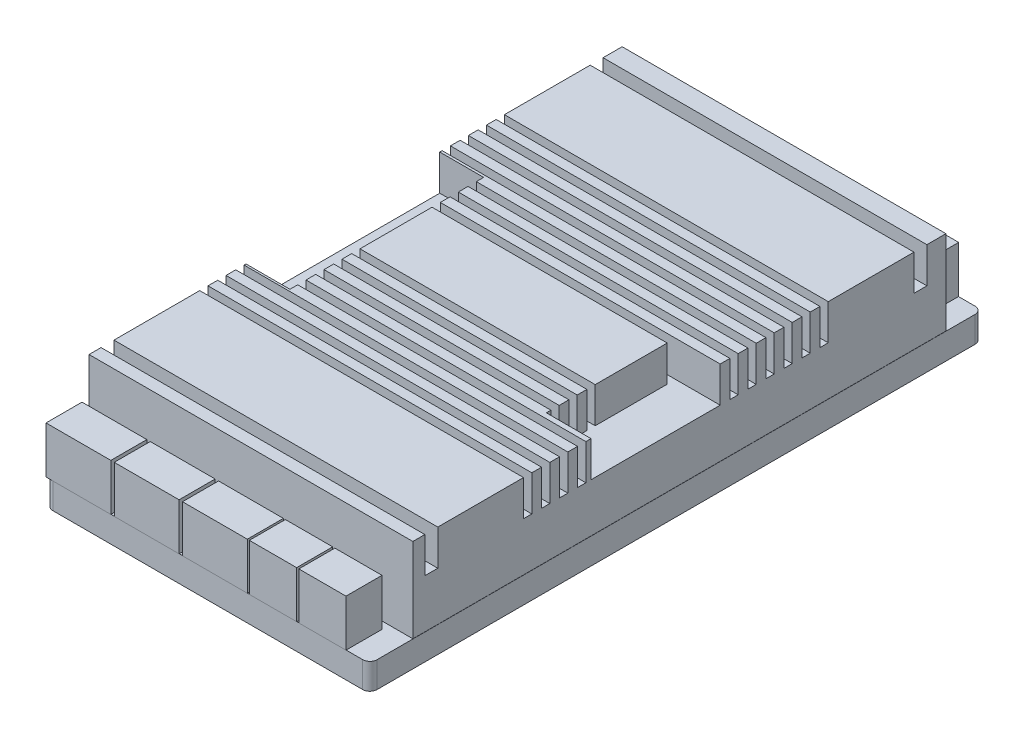
from build123d import *

# Parameters (mm, degrees)
BOSS_EXTRUDE1_DEPTH = 7.2
SKETCH2_W           = 89.9
SKETCH2_H           = 148
BOSS_EXTRUDE2_DEPTH = 23.4
SKETCH3_W           = 12.2
SKETCH3_H           = 53.8
SKETCH3_W_2         = 12.4
SKETCH3_H_2         = 34.48
CUT_EXTRUDE1_DEPTH  = 9.9
SKETCH4_W           = 89.9
SKETCH4_H           = 3.586904051
SKETCH4_W_2         = 90
SKETCH4_H_2         = 2.297698364
CUT_EXTRUDE2_DEPTH  = 9.9
SKETCH5_W           = 18
SKETCH5_H           = 10
SKETCH5_W_2         = 13.128765808
SKETCH5_W_3         = 13.081709299
BOSS_EXTRUDE3_DEPTH = 13


with BuildPart() as part:
    # Sketch1 → Boss-Extrude1 (new body)
    with BuildSketch(Plane(origin=(0, 0, 0), x_dir=(1, 0, 0), z_dir=(0, 1, 0))):
        with BuildLine():
            Line((43, -85), (-43, -85))
            ThreePointArc((-43, -85), (-44.414213562, -84.414213562), (-45, -83))
            Line((-45, -83), (-45, 83))
            ThreePointArc((-45, 83), (-44.414213562, 84.414213562), (-43, 85))
            Line((-43, 85), (43, 85))
            ThreePointArc((43, 85), (44.414213562, 84.414213562), (45, 83))
            Line((45, 83), (45, -83))
            ThreePointArc((45, -83), (44.414213562, -84.414213562), (43, -85))
        make_face()
    extrude(amount=BOSS_EXTRUDE1_DEPTH)

    # Sketch2 → Boss-Extrude2 (add)
    with BuildSketch(Plane(origin=(0, 7.2, 0), x_dir=(1, 0, 0), z_dir=(0, 1, 0))):
        with Locations((0, 0.976122618)):
            Rectangle(SKETCH2_W, SKETCH2_H)
    extrude(amount=BOSS_EXTRUDE2_DEPTH)

    # Sketch3 → Cut-Extrude1 (cut)
    with BuildSketch(Plane(origin=(0, 30.6, 0), x_dir=(1, 0, 0), z_dir=(0, 1, 0))):
        with Locations((-38.85, -2.560293939)):
            Rectangle(SKETCH3_W, SKETCH3_H)
        with Locations((38.75, -6.331083764)):
            Rectangle(SKETCH3_W_2, SKETCH3_H_2)
    extrude(amount=-CUT_EXTRUDE1_DEPTH, mode=Mode.SUBTRACT)

    # Sketch4 → Cut-Extrude2 (cut)
    with BuildSketch(Plane(origin=(0, 30.6, 0), x_dir=(1, 0, 0), z_dir=(0, 1, 0))):
        with Locations((0, 67.894969538)):
            Rectangle(SKETCH4_W, SKETCH4_H)
        with Locations((0, 11.148849182)):
            Rectangle(SKETCH4_W_2, SKETCH4_H_2)
        with Locations((0, 16.148849182)):
            Rectangle(SKETCH4_W_2, SKETCH4_H_2)
        with Locations((0, 21.148849182)):
            Rectangle(SKETCH4_W_2, SKETCH4_H_2)
        with Locations((0, 26.148849182)):
            Rectangle(SKETCH4_W_2, SKETCH4_H_2)
        with Locations((0, 31.148849182)):
            Rectangle(SKETCH4_W_2, SKETCH4_H_2)
        with Locations((0, 36.148849182)):
            Rectangle(SKETCH4_W_2, SKETCH4_H_2)
        with Locations((0, 41.148849182)):
            Rectangle(SKETCH4_W_2, SKETCH4_H_2)
        with Locations((0, -41.148849182)):
            Rectangle(SKETCH4_W_2, SKETCH4_H_2)
        with Locations((0, -36.148849182)):
            Rectangle(SKETCH4_W_2, SKETCH4_H_2)
        with Locations((0, -31.148849182)):
            Rectangle(SKETCH4_W_2, SKETCH4_H_2)
        with Locations((0, -26.148849182)):
            Rectangle(SKETCH4_W_2, SKETCH4_H_2)
        with Locations((0, -21.148849182)):
            Rectangle(SKETCH4_W_2, SKETCH4_H_2)
        with Locations((0, -16.148849182)):
            Rectangle(SKETCH4_W_2, SKETCH4_H_2)
        with Locations((0, -11.148849182)):
            Rectangle(SKETCH4_W_2, SKETCH4_H_2)
        with Locations((0, -67.894969538)):
            Rectangle(SKETCH4_W, SKETCH4_H)
    extrude(amount=-CUT_EXTRUDE2_DEPTH, mode=Mode.SUBTRACT)

    # Sketch5 → Boss-Extrude3 (add)
    with BuildSketch(Plane(origin=(0, 7.2, 0), x_dir=(1, 0, 0), z_dir=(0, 1, 0))):
        with Locations((-35.870753406, -80.05)):
            Rectangle(SKETCH5_W, SKETCH5_H)
        with Locations((-16.922452044, -80.05)):
            Rectangle(SKETCH5_W, SKETCH5_H)
        with Locations((2.025849319, -80.05)):
            Rectangle(SKETCH5_W, SKETCH5_H)
        with Locations((18.149473412, -80.05)):
            Rectangle(SKETCH5_W_2, SKETCH5_H)
        with Locations((31.866445574, -80.05)):
            Rectangle(SKETCH5_W_3, SKETCH5_H)
        with Locations((31.866445574, 80.05)):
            Rectangle(SKETCH5_W_3, SKETCH5_H)
        with Locations((18.149473412, 80.05)):
            Rectangle(SKETCH5_W_2, SKETCH5_H)
        with Locations((2.025849319, 80.05)):
            Rectangle(SKETCH5_W, SKETCH5_H)
        with Locations((-16.922452044, 80.05)):
            Rectangle(SKETCH5_W, SKETCH5_H)
        with Locations((-35.870753406, 80.05)):
            Rectangle(SKETCH5_W, SKETCH5_H)
    extrude(amount=BOSS_EXTRUDE3_DEPTH)


solid = part.part
